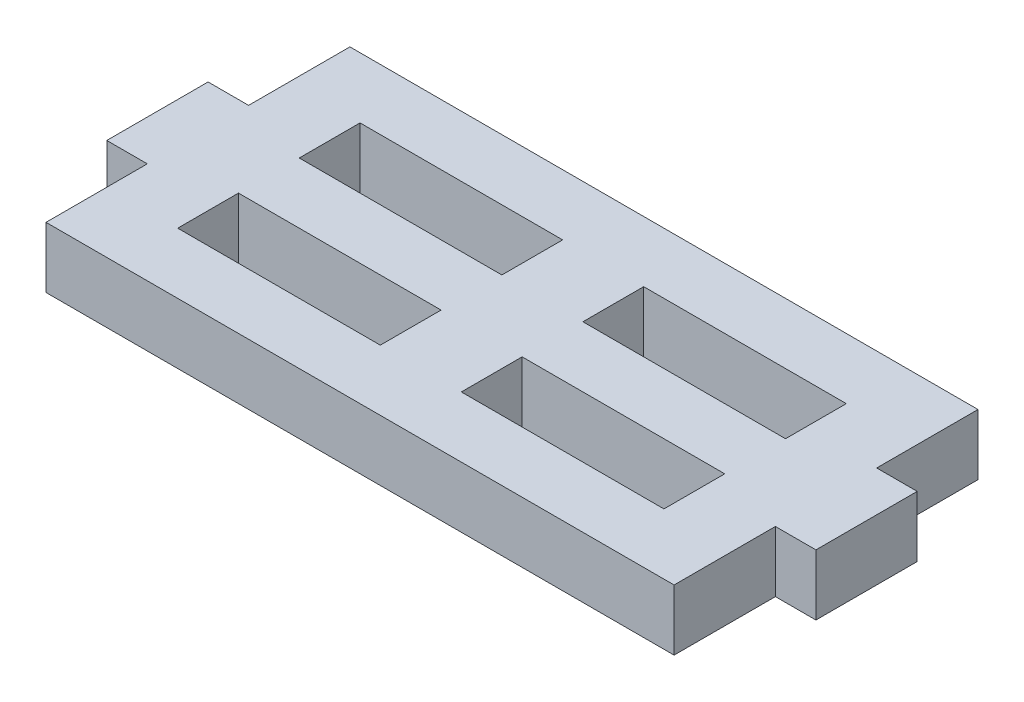
from build123d import *

# Parameters (mm, degrees)
SKETCH1_W           = 35
SKETCH1_H           = 15
BOSS_EXTRUDE1_DEPTH = 3
SKETCH2_W           = 10
SKETCH2_H           = 3
CUT_EXTRUDE1_DEPTH  = 3
SKETCH3_W           = 2
SKETCH3_H           = 5
CUT_EXTRUDE2_DEPTH  = 3


with BuildPart() as part:
    # Sketch1 → Boss-Extrude1 (new body)
    with BuildSketch(Plane(origin=(0, 0, 0), x_dir=(1, 0, 0), z_dir=(0, 1, 0))):
        Rectangle(SKETCH1_W, SKETCH1_H)
    extrude(amount=BOSS_EXTRUDE1_DEPTH)

    # Sketch2 → Cut-Extrude1 (cut)
    with BuildSketch(Plane(origin=(0, 3, 0), x_dir=(1, 0, 0), z_dir=(0, 1, 0))):
        with Locations((-7, -3)):
            Rectangle(SKETCH2_W, SKETCH2_H)
        with Locations((-7, 3)):
            Rectangle(SKETCH2_W, SKETCH2_H)
        with Locations((7, -3)):
            Rectangle(SKETCH2_W, SKETCH2_H)
        with Locations((7, 3)):
            Rectangle(SKETCH2_W, SKETCH2_H)
    extrude(amount=-CUT_EXTRUDE1_DEPTH, mode=Mode.SUBTRACT)

    # Sketch3 → Cut-Extrude2 (cut)
    with BuildSketch(Plane(origin=(0, 3, 0), x_dir=(1, 0, 0), z_dir=(0, 1, 0))):
        with Locations((16.5, 5)):
            Rectangle(SKETCH3_W, SKETCH3_H)
        with Locations((16.5, -5)):
            Rectangle(SKETCH3_W, SKETCH3_H)
        with Locations((-16.5, -5)):
            Rectangle(SKETCH3_W, SKETCH3_H)
        with Locations((-16.5, 5)):
            Rectangle(SKETCH3_W, SKETCH3_H)
    extrude(amount=-CUT_EXTRUDE2_DEPTH, mode=Mode.SUBTRACT)


solid = part.part
